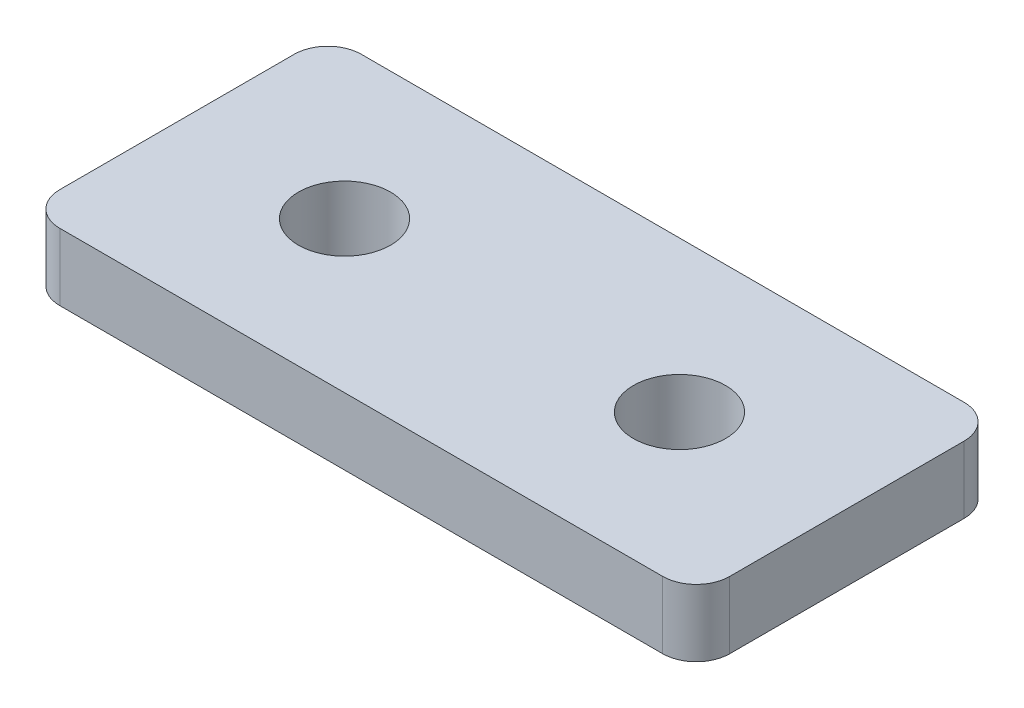
from build123d import *

# Parameters (mm, degrees)
SKETCH_1_W          = 40
SKETCH_1_H          = 18
EXTRUDE_1_DEPTH     = 4
SKETCH_2_R          = 2.75
CUT_EXTRUDE_1_DEPTH = 4
FILLET_1_R          = 2


with BuildPart() as part:
    # 草图1 → 凸台-拉伸1 (new body)
    with BuildSketch(Plane(origin=(0, 0, 0), x_dir=(1, 0, 0), z_dir=(0, 1, 0))):
        Rectangle(SKETCH_1_W, SKETCH_1_H)
    extrude(amount=EXTRUDE_1_DEPTH)

    # 草图2 → 切除-拉伸1 (cut)
    with BuildSketch(Plane(origin=(0, 4, 0), x_dir=(1, 0, 0), z_dir=(0, 1, 0))):
        with Locations(Location((-10, 0, 0), (0, 0, 270))):
            Circle(SKETCH_2_R)
        with Locations(Location((10, 0, 0), (0, 0, 90))):
            Circle(SKETCH_2_R)
    extrude(amount=-CUT_EXTRUDE_1_DEPTH, mode=Mode.SUBTRACT)

    # 圆角1
    fillet_1_edges = [part.edges().sort_by_distance(p)[0] for p in [
        (20, 2, 9),
        (-20, 2, 9),
        (-20, 2, -9),
        (20, 2, -9),
    ]]
    fillet(fillet_1_edges, radius=FILLET_1_R)


solid = part.part
